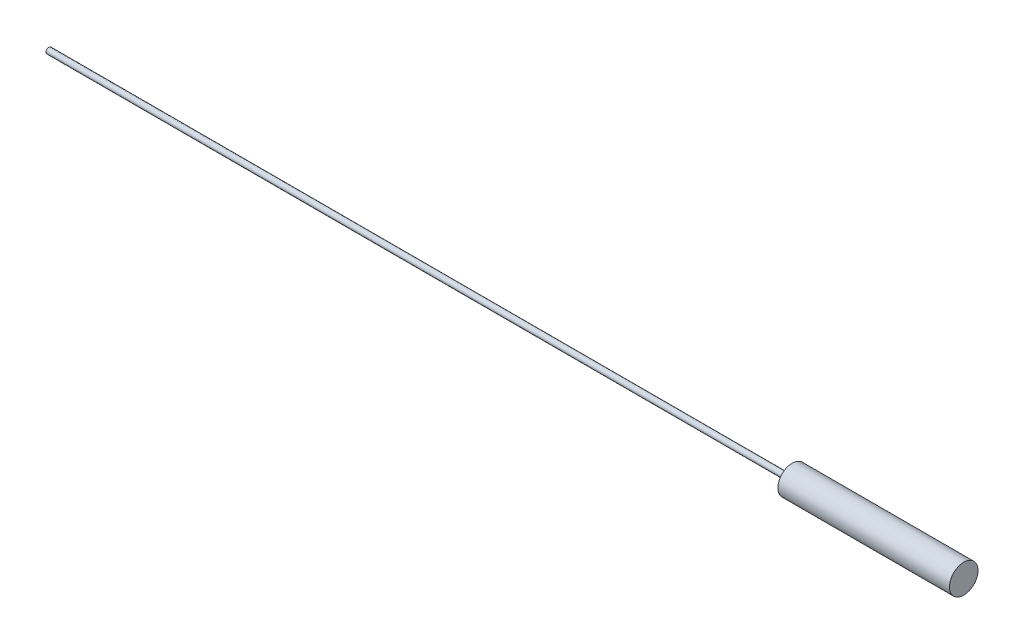
from build123d import *

# Parameters (mm, degrees)
SKETCH1_W           = 120
SKETCH1_H           = 10
SKETCH31_R          = 2
BOSS_EXTRUDE2_DEPTH = 520


with BuildPart() as part:
    # Sketch1 → Revolve1 (revolve)
    with BuildSketch(Plane(origin=(0, 0, 0), x_dir=(1, 0, 0), z_dir=(0, 1, 0))):
        with Locations((0, -1.574414786)):
            Rectangle(SKETCH1_W, SKETCH1_H)
    revolve(axis=Axis((-60, 0, -3.425585214), (1, 0, 0)))

    # Sketch31 → Boss-Extrude2 (add)
    with BuildSketch(Plane.ZY.offset(60)):
        with Locations((-3.425585214, 0)):
            Circle(SKETCH31_R)
    extrude(amount=BOSS_EXTRUDE2_DEPTH)


solid = part.part
